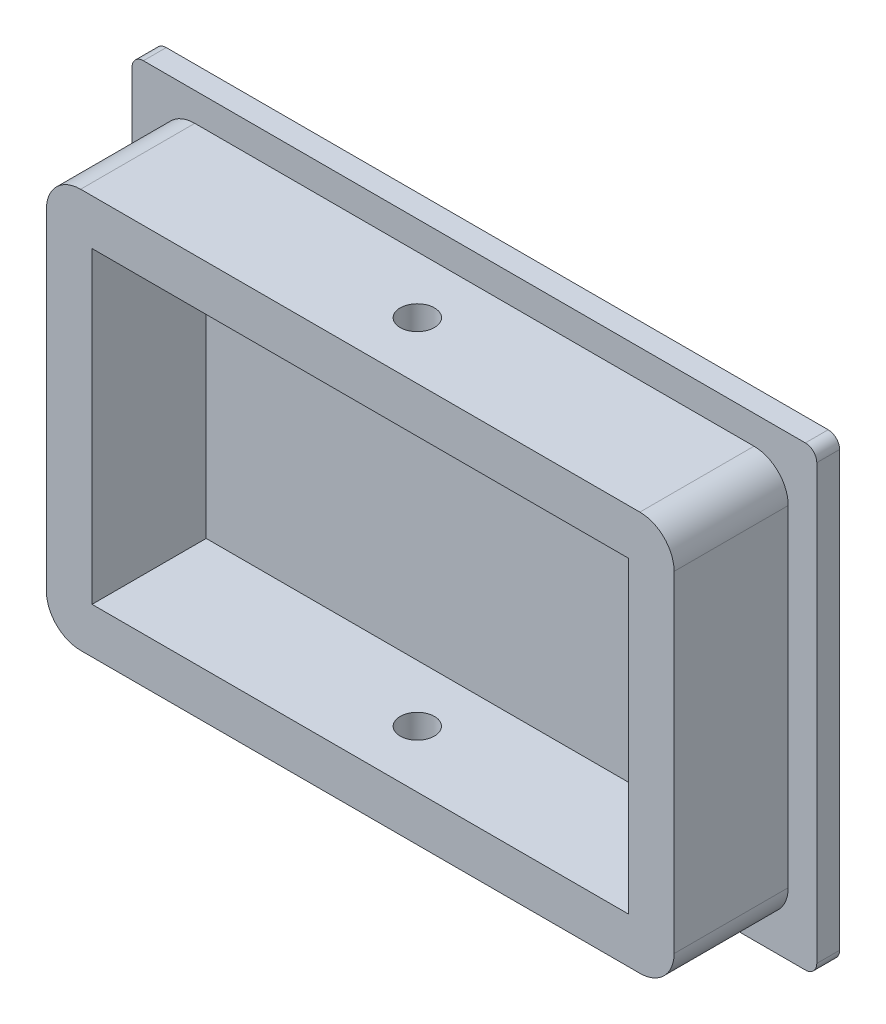
from build123d import *

# Parameters (mm, degrees)
ESQUISSE1_W             = 60
ESQUISSE1_H             = 40
BOSS_EXTRU_1_DEPTH      = 2
ESQUISSE2_W             = 55
ESQUISSE2_H             = 35
BOSS_EXTRU_2_DEPTH      = 10
CONG_1_R                = 3
CONG_2_R                = 1
ESQUISSE3_W             = 47
ESQUISSE3_H             = 27
ENL_V_MAT_EXTRU_1_DEPTH = 10
ESQUISSE4_R             = 1.5
ENL_V_MAT_EXTRU_2_DEPTH = 72.765242283


with BuildPart() as part:
    # Esquisse1 → Boss.-Extru.1 (new body)
    with BuildSketch(Plane.XY):
        with Locations((30, 20)):
            Rectangle(ESQUISSE1_W, ESQUISSE1_H)
    extrude(amount=BOSS_EXTRU_1_DEPTH)

    # Esquisse2 → Boss.-Extru.2 (add)
    with BuildSketch(Plane.XY.offset(2)):
        with Locations((30, 20)):
            Rectangle(ESQUISSE2_W, ESQUISSE2_H)
    extrude(amount=BOSS_EXTRU_2_DEPTH)

    # Congé1
    cong_1_edges = [part.edges().sort_by_distance(p)[0] for p in [
        (57.5, 37.5, 7),
        (2.5, 37.5, 7),
        (2.5, 2.5, 7),
        (57.5, 2.5, 7),
    ]]
    fillet(cong_1_edges, radius=CONG_1_R)

    # Congé2
    cong_2_edges = [part.edges().sort_by_distance(p)[0] for p in [
        (0, 40, 1),
        (60, 40, 1),
        (60, 0, 1),
        (0, 0, 1),
    ]]
    fillet(cong_2_edges, radius=CONG_2_R)

    # Esquisse3 → Enlèv. mat.-Extru.1 (cut)
    with BuildSketch(Plane.XY.offset(12)):
        with Locations((30, 20)):
            Rectangle(ESQUISSE3_W, ESQUISSE3_H)
    extrude(amount=-ENL_V_MAT_EXTRU_1_DEPTH, mode=Mode.SUBTRACT)

    # Esquisse4 → Enlèv. mat.-Extru.2 (cut, through all)
    with BuildSketch(Plane(origin=(0, 37.5, 0), x_dir=(1, 0, 0), z_dir=(0, 1, 0))):
        with Locations(Location((30, -7, 0), (0, 0, 270))):
            Circle(ESQUISSE4_R)
    extrude(amount=-ENL_V_MAT_EXTRU_2_DEPTH, mode=Mode.SUBTRACT)


solid = part.part
